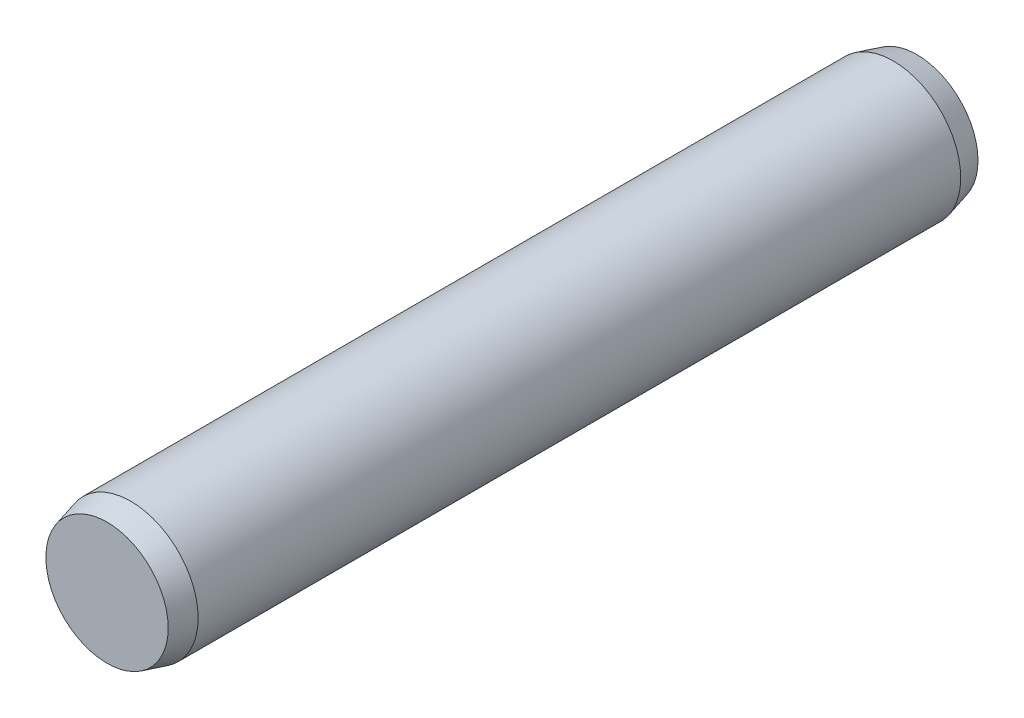
from build123d import *


with BuildPart() as part:
    # Sketch3 → Revolve1 (revolve)
    with BuildSketch(Plane(origin=(0, 0, 0), x_dir=(0, 0, -1), z_dir=(1, 0, 0)), mode=Mode.PRIVATE) as revolve1_sk:
        Polygon((-6, 0), (-6, 0.906217783), (-5.65, 1), (5.65, 1), (6, 0.906217783), (6, 0), align=None)
    revolve(revolve1_sk.sketch.rotate(Axis((0, 0, 6), (0, 0, -1)), 90), axis=Axis((0, 0, 6), (0, 0, -1)))


solid = part.part
